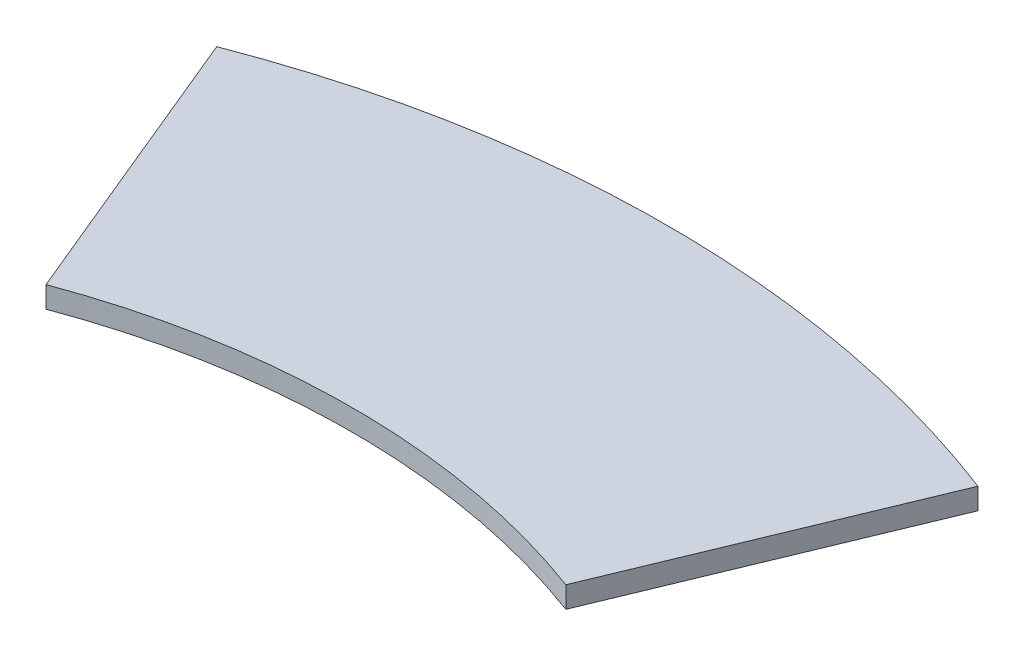
from build123d import *

# Parameters (mm, degrees)
BOSS_EXTRUDE1_DEPTH = 5


with BuildPart() as part:
    # Sketch1 → Boss-Extrude1 (new, symmetric)
    with BuildSketch(Plane(origin=(0, 0, 0), x_dir=(1, 0, 0), z_dir=(0, 1, 0))):
        with BuildLine():
            Line((-178.073496481, 52.400290961), (-121.408093467, -84.402093513))
            ThreePointArc((-121.408093467, -84.402093513), (0.610072251, -62.510840335), (122.628237969, -84.402093513))
            Line((122.628237969, -84.402093513), (179.293640982, 52.400290961))
            ThreePointArc((179.293640982, 52.400290961), (0.610072251, 85.489159665), (-178.073496481, 52.400290961))
        make_face()
    extrude(amount=BOSS_EXTRUDE1_DEPTH, both=True)


solid = part.part
